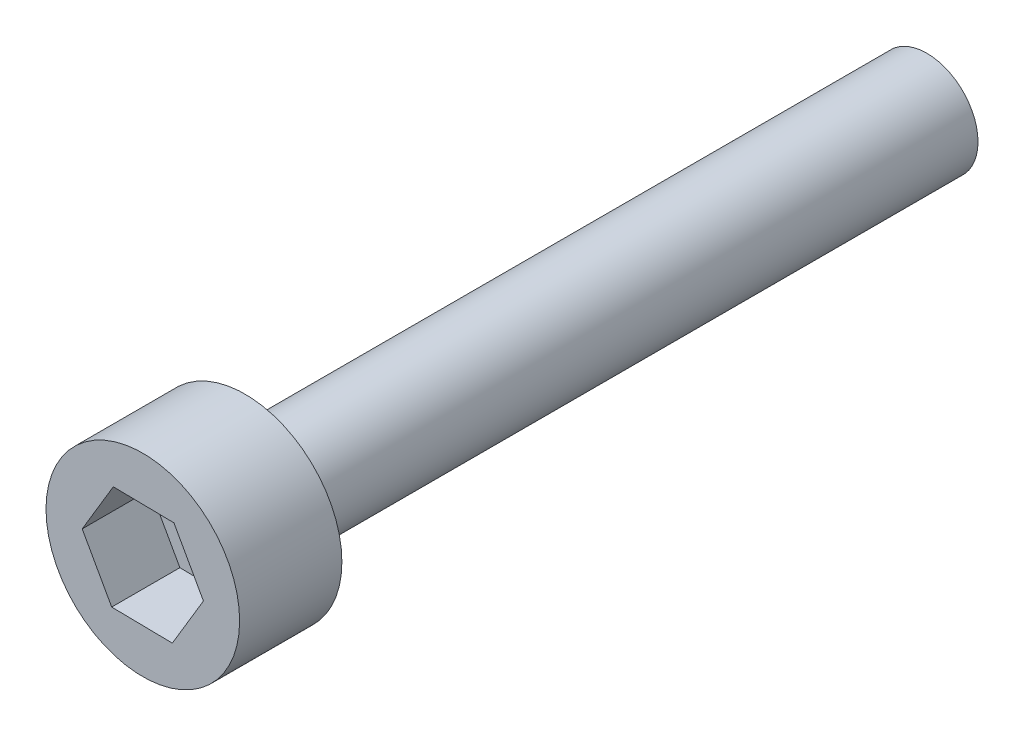
from build123d import *

# Parameters (mm, degrees)
SKETCH_1_R          = 2.84
EXTRUDE_1_DEPTH     = 3
SKETCH_2_R          = 1.5
EXTRUDE_2_DEPTH     = 20
CUT_EXTRUDE_1_DEPTH = 2


with BuildPart() as part:
    # 草图1 → 凸台-拉伸1 (new body)
    with BuildSketch(Plane.XY):
        Circle(SKETCH_1_R)
    extrude(amount=EXTRUDE_1_DEPTH)

    # 草图2 → 凸台-拉伸2 (add)
    with BuildSketch(Plane(origin=(0, 0, 0), x_dir=(-1, 0, 0), z_dir=(0, 0, -1))):
        with Locations(Location((0, 0, 0), (0, 0, 180))):
            Circle(SKETCH_2_R)
    extrude(amount=EXTRUDE_2_DEPTH)

    # 草图3 → 切除-拉伸1 (cut)
    with BuildSketch(Plane.XY.offset(3)):
        Polygon((0.912581429, 1.526213769), (-0.865449181, 1.553425585), (-1.77803061, 0.027211816), (-0.912581429, -1.526213769), (0.865449181, -1.553425585), (1.77803061, -0.027211816), align=None)
    extrude(amount=-CUT_EXTRUDE_1_DEPTH, mode=Mode.SUBTRACT)


solid = part.part
